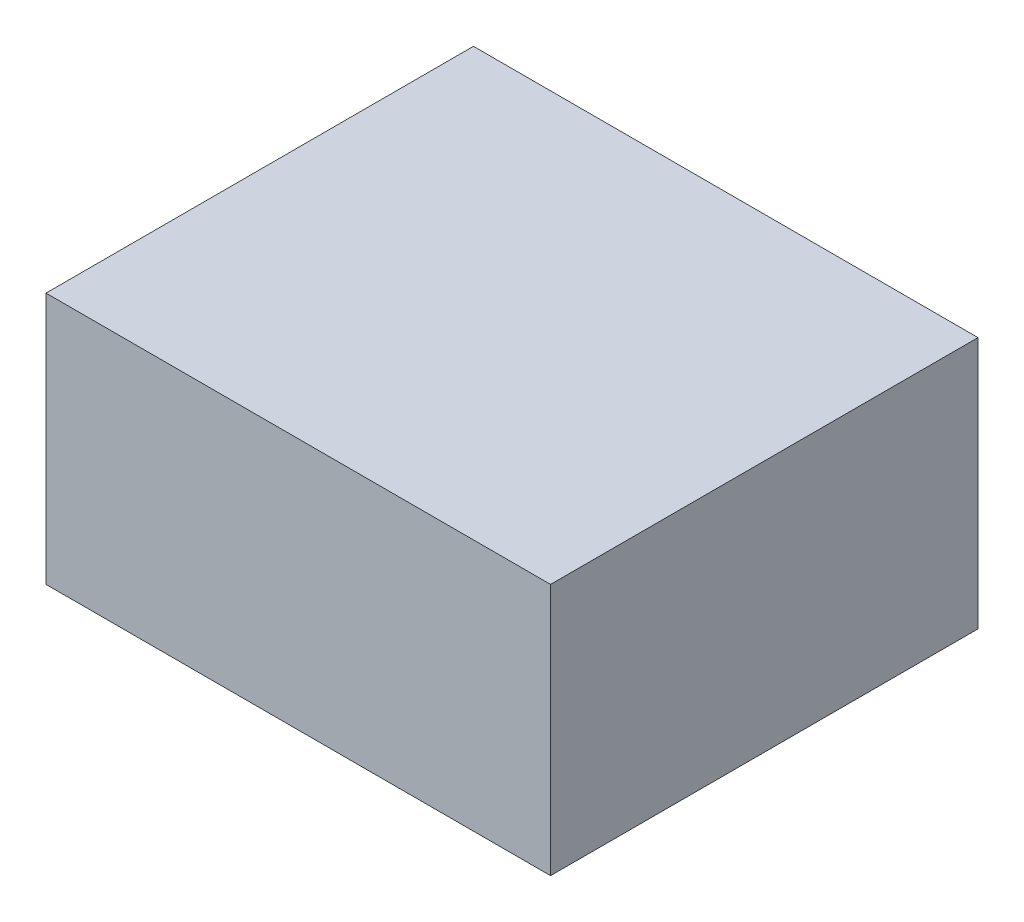
from build123d import *

# Parameters (mm, degrees)
SKETCH1_W           = 14.990510065
SKETCH1_H           = 7.495255032
BOSS_EXTRUDE1_DEPTH = 12.7


with BuildPart() as part:
    # Sketch1 → Boss-Extrude1 (new body)
    with BuildSketch(Plane.XY):
        with Locations((7.495255033, 3.747627516)):
            Rectangle(SKETCH1_W, SKETCH1_H)
    extrude(amount=BOSS_EXTRUDE1_DEPTH)


solid = part.part
